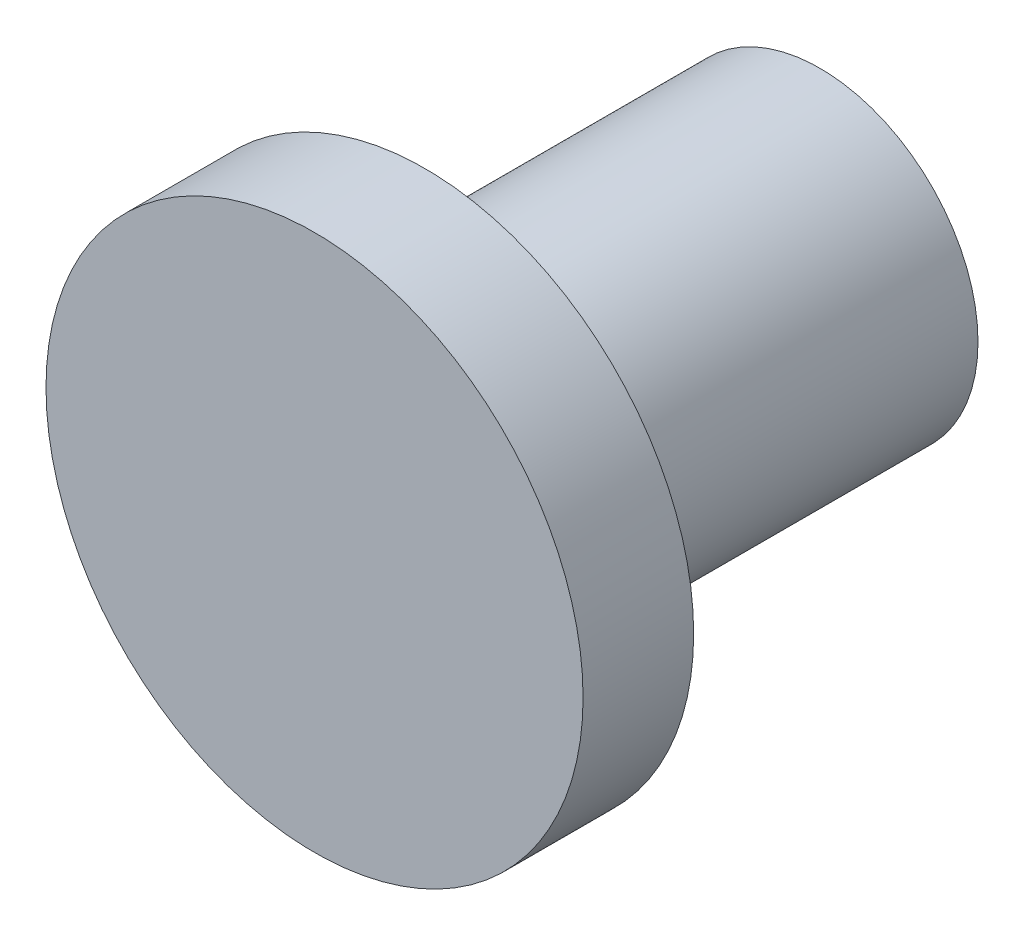
from build123d import *

# Parameters (mm, degrees)
THREAD_ENVELOPE_START = -2.5
SKETCH1_R             = 1
THREAD_ENVELOPE_DEPTH = 2.5
SKETCH2_R             = 1.7
HEAD_ENVELOPE_DEPTH   = 0.7


with BuildPart() as part:
    # Sketch1 → Thread_Envelope (new body)
    with BuildSketch(Plane.XY.offset(THREAD_ENVELOPE_START)):
        Circle(SKETCH1_R)
    extrude(amount=THREAD_ENVELOPE_DEPTH)

    # Sketch2 → Head_Envelope (add)
    with BuildSketch(Plane.XY):
        Circle(SKETCH2_R)
    extrude(amount=HEAD_ENVELOPE_DEPTH)


solid = part.part
